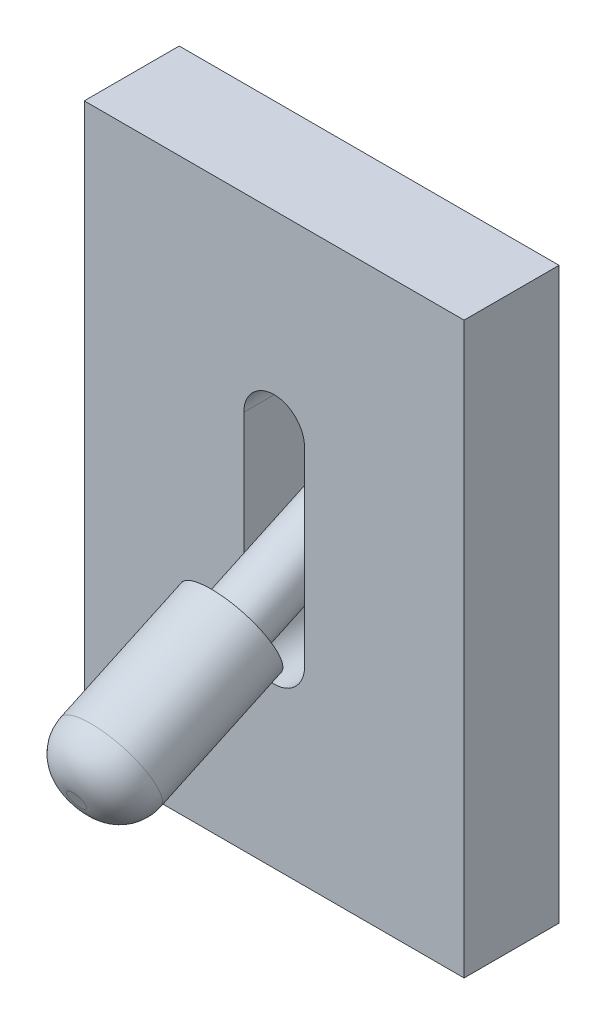
from build123d import *

# Parameters (mm, degrees)
SKETCH_1_W          = 20
SKETCH_1_H          = 30
EXTRUDE_1_DEPTH     = 5
CUT_EXTRUDE_1_REACH = 150.209
FILLET_1_R          = 2


with BuildPart() as part:
    # Эскиз1 → Бобышка-Вытянуть1 (new body)
    with BuildSketch(Plane(origin=(0, 0, -2), x_dir=(-1, 0, 0), z_dir=(0, 0, -1))):
        with Locations((136, -10)):
            Rectangle(SKETCH_1_W, SKETCH_1_H)
    extrude(amount=EXTRUDE_1_DEPTH)

    # Эскиз2 → Вырез-Вытянуть1 (cut, up to next)
    with BuildSketch(Plane.XY.offset(-2), mode=Mode.PRIVATE) as cut_extrude_1_sk1:
        with BuildLine():
            Line((-134.4, -5), (-134.4, -15))
            ThreePointArc((-134.4, -15), (-136, -16.6), (-137.6, -15))
            Line((-137.6, -15), (-137.6, -5))
            ThreePointArc((-137.6, -5), (-136, -3.4), (-134.4, -5))
        make_face()
    cut_extrude_1_tool1 = extrude(cut_extrude_1_sk1.sketch, amount=-CUT_EXTRUDE_1_REACH, mode=Mode.PRIVATE) & part.part
    add(cut_extrude_1_tool1.solids().sort_by_distance((-136, -10, -2))[0], mode=Mode.SUBTRACT)


with BuildPart() as body_2:
    # Эскиз4 → Повернуть1 (revolve)
    with BuildSketch(Plane(origin=(-136, 0, -136), x_dir=(0, 0, -1), z_dir=(1, 0, 0))):
        Polygon((-144.40723238, -16.68451045), (-145.463778034, -14.418740982), (-137.307007951, -10.615176626), (-136.884389689, -11.521484413), (-129.633927393, -8.140538319), (-129, -9.5), align=None)
    revolve(axis=Axis((-136, -9.5, -7), (0, -0.42261826174069383, 0.9063077870366526)))

    # Скругление1
    fillet_1_edges = [body_2.edges().sort_by_distance(p)[0] for p in [
        (-136, -18.950279917, 7.350686725),
    ]]
    fillet(fillet_1_edges, radius=FILLET_1_R)


solid = Compound([part.part, body_2.part])
